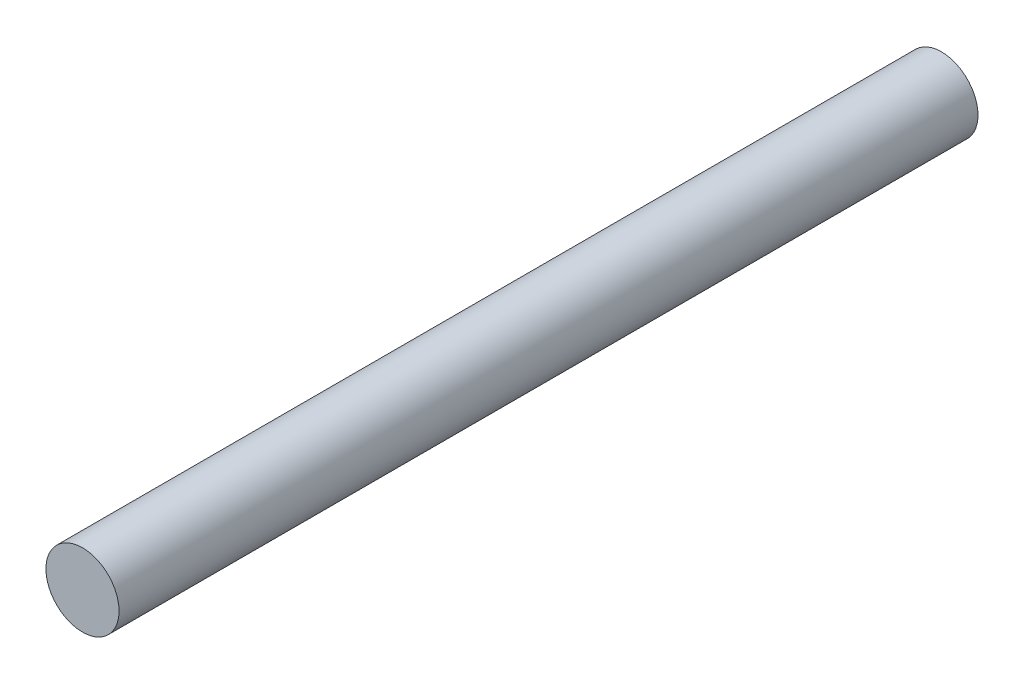
from build123d import *

# Parameters (mm, degrees)
SKETCH1_R           = 1.5875
BOSS_EXTRUDE1_DEPTH = 37.30625


with BuildPart() as part:
    # Sketch1 → Boss-Extrude1 (new body)
    with BuildSketch(Plane.XY):
        Circle(SKETCH1_R)
    extrude(amount=BOSS_EXTRUDE1_DEPTH)


solid = part.part
